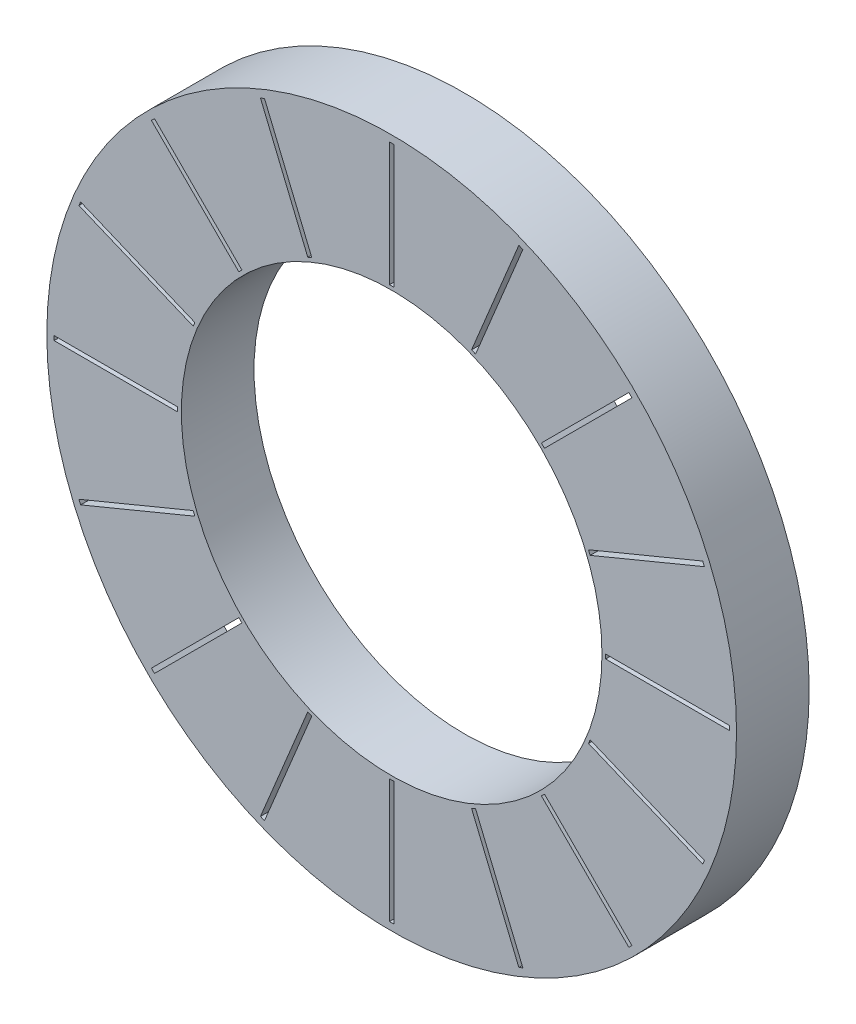
from build123d import *

# Parameters (mm, degrees)
ESQUISSE1_R             = 46.46108
BOSS_EXTRU_1_DEPTH      = 10
ESQUISSE2_R             = 29.44481
ENL_V_MAT_EXTRU_1_DEPTH = 67.462500025
ESQUISSE4_W             = 0.6
ESQUISSE4_H             = 40
ESQUISSE4_W_2           = 40
ESQUISSE4_H_2           = 0.6
ENL_V_MAT_EXTRU_2_DEPTH = 10
ESQUISSE5_R             = 29.44481
BOSS_EXTRU_2_DEPTH      = 10
ESQUISSE6_R             = 28.94481
ENL_V_MAT_EXTRU_3_DEPTH = 67.461145864
ESQUISSE7_R             = 47.46108
ESQUISSE7_R_2           = 46.46108
BOSS_EXTRU_3_DEPTH      = 10


with BuildPart() as part:
    # Esquisse1 → Boss.-Extru.1 (new body)
    with BuildSketch(Plane.XY):
        Circle(ESQUISSE1_R)
    extrude(amount=BOSS_EXTRU_1_DEPTH)

    # Esquisse2 → Enlèv. mat.-Extru.1 (cut, through all)
    with BuildSketch(Plane.XY.offset(10)):
        Circle(ESQUISSE2_R)
    extrude(amount=-ENL_V_MAT_EXTRU_1_DEPTH, mode=Mode.SUBTRACT)

    # Esquisse4 → Enlèv. mat.-Extru.2 (cut)
    with BuildSketch(Plane.XY.offset(10)):
        Polygon((23.238169802, 55.317966921), (7.930832507, 18.362785621), (7.376504788, 18.59239568), (22.683842082, 55.54757698), align=None)
        with Locations((0, 40)):
            Rectangle(ESQUISSE4_W, ESQUISSE4_H)
        Polygon((42.638538906, 42.214274837), (14.354267658, 13.930003589), (13.930003589, 14.354267658), (42.214274837, 42.638538906), align=None)
        Polygon((55.54757698, 22.683842082), (18.59239568, 7.376504788), (18.362785621, 7.930832507), (55.317966921, 23.238169802), align=None)
        with Locations((40, 0)):
            Rectangle(ESQUISSE4_W_2, ESQUISSE4_H_2)
        Polygon((55.317966921, -23.238169802), (18.362785621, -7.930832507), (18.59239568, -7.376504788), (55.54757698, -22.683842082), align=None)
        Polygon((42.214274837, -42.638538906), (13.930003589, -14.354267658), (14.354267658, -13.930003589), (42.638538906, -42.214274837), align=None)
        Polygon((22.683842082, -55.54757698), (7.376504788, -18.59239568), (7.930832507, -18.362785621), (23.238169802, -55.317966921), align=None)
        with Locations((0, -40)):
            Rectangle(ESQUISSE4_W, ESQUISSE4_H)
        Polygon((-23.238169802, -55.317966921), (-7.930832507, -18.362785621), (-7.376504788, -18.59239568), (-22.683842082, -55.54757698), align=None)
        Polygon((-42.638538906, -42.214274837), (-14.354267658, -13.930003589), (-13.930003589, -14.354267658), (-42.214274837, -42.638538906), align=None)
        Polygon((-55.54757698, -22.683842082), (-18.59239568, -7.376504788), (-18.362785621, -7.930832507), (-55.317966921, -23.238169802), align=None)
        with Locations((-40, 0)):
            Rectangle(ESQUISSE4_W_2, ESQUISSE4_H_2)
        Polygon((-55.317966921, 23.238169802), (-18.362785621, 7.930832507), (-18.59239568, 7.376504788), (-55.54757698, 22.683842082), align=None)
        Polygon((-42.214274837, 42.638538906), (-13.930003589, 14.354267658), (-14.354267658, 13.930003589), (-42.638538906, 42.214274837), align=None)
        Polygon((-22.683842082, 55.54757698), (-7.376504788, 18.59239568), (-7.930832507, 18.362785621), (-23.238169802, 55.317966921), align=None)
    extrude(amount=-ENL_V_MAT_EXTRU_2_DEPTH, mode=Mode.SUBTRACT)


with BuildPart() as enl_v_mat_extru_2_piece_1:
    # of the separate pieces the step leaves, piece 1, a body of its own (enl_v_mat_extru_2_pieces)
    add(part.part.solids().sort_by_distance((-32.640127818, -33.064391886, 0))[0])



with BuildPart() as enl_v_mat_extru_2_piece_2:
    # of the separate pieces the step leaves, piece 2, a body of its own (enl_v_mat_extru_2_pieces)
    add(part.part.solids().sort_by_distance((-18.056678773, 42.808741005, 0))[0])


with BuildPart() as enl_v_mat_extru_2_piece_3:
    # of the separate pieces the step leaves, piece 3, a body of its own (enl_v_mat_extru_2_pieces)
    add(part.part.solids().sort_by_distance((-42.808741005, -18.056678773, 0))[0])


with BuildPart() as enl_v_mat_extru_2_piece_4:
    # of the separate pieces the step leaves, piece 4, a body of its own (enl_v_mat_extru_2_pieces)
    add(part.part.solids().sort_by_distance((-33.064391886, 32.640127818, 0))[0])


with BuildPart() as enl_v_mat_extru_2_piece_5:
    # of the separate pieces the step leaves, piece 5, a body of its own (enl_v_mat_extru_2_pieces)
    add(part.part.solids().sort_by_distance((17.502351053, 43.038351065, 0))[0])


with BuildPart() as enl_v_mat_extru_2_piece_6:
    # of the separate pieces the step leaves, piece 6, a body of its own (enl_v_mat_extru_2_pieces)
    add(part.part.solids().sort_by_distance((0.3, -46.460111437, 0))[0])


with BuildPart() as enl_v_mat_extru_2_piece_7:
    # of the separate pieces the step leaves, piece 7, a body of its own (enl_v_mat_extru_2_pieces)
    add(part.part.solids().sort_by_distance((-0.3, 46.460111437, 0))[0])


with BuildPart() as enl_v_mat_extru_2_piece_8:
    # of the separate pieces the step leaves, piece 8, a body of its own (enl_v_mat_extru_2_pieces)
    add(part.part.solids().sort_by_distance((46.460111437, 0.3, 0))[0])


with BuildPart() as enl_v_mat_extru_2_piece_9:
    # of the separate pieces the step leaves, piece 9, a body of its own (enl_v_mat_extru_2_pieces)
    add(part.part.solids().sort_by_distance((43.038351065, -17.502351053, 0))[0])


with BuildPart() as enl_v_mat_extru_2_piece_10:
    # of the separate pieces the step leaves, piece 10, a body of its own (enl_v_mat_extru_2_pieces)
    add(part.part.solids().sort_by_distance((-17.502351053, -43.038351065, 0))[0])


with BuildPart() as enl_v_mat_extru_2_piece_11:
    # of the separate pieces the step leaves, piece 11, a body of its own (enl_v_mat_extru_2_pieces)
    add(part.part.solids().sort_by_distance((32.640127818, 33.064391886, 0))[0])


with BuildPart() as enl_v_mat_extru_2_piece_12:
    # of the separate pieces the step leaves, piece 12, a body of its own (enl_v_mat_extru_2_pieces)
    add(part.part.solids().sort_by_distance((42.808741005, 18.056678773, 0))[0])


with BuildPart() as enl_v_mat_extru_2_piece_13:
    # of the separate pieces the step leaves, piece 13, a body of its own (enl_v_mat_extru_2_pieces)
    add(part.part.solids().sort_by_distance((18.056678773, -42.808741005, 0))[0])


with BuildPart() as enl_v_mat_extru_2_piece_14:
    # of the separate pieces the step leaves, piece 14, a body of its own (enl_v_mat_extru_2_pieces)
    add(part.part.solids().sort_by_distance((33.064391886, -32.640127818, 0))[0])


with BuildPart() as enl_v_mat_extru_2_piece_15:
    # of the separate pieces the step leaves, piece 15, a body of its own (enl_v_mat_extru_2_pieces)
    add(part.part.solids().sort_by_distance((-46.460111437, -0.3, 0))[0])


with BuildPart() as enl_v_mat_extru_2_piece_16:
    # of the separate pieces the step leaves, piece 16, a body of its own (enl_v_mat_extru_2_pieces)
    add(part.part.solids().sort_by_distance((-43.038351065, 17.502351053, 0))[0])


with BuildPart() as enl_v_mat_extru_2_piece_1_1:
    add(enl_v_mat_extru_2_piece_1.part)

    add(enl_v_mat_extru_2_piece_2.part)  # Boss.-Extru.2 merges Enlèv. mat.-Extru.2 piece 2

    add(enl_v_mat_extru_2_piece_3.part)  # Boss.-Extru.2 merges Enlèv. mat.-Extru.2 piece 3

    add(enl_v_mat_extru_2_piece_4.part)  # Boss.-Extru.2 merges Enlèv. mat.-Extru.2 piece 4

    add(enl_v_mat_extru_2_piece_5.part)  # Boss.-Extru.2 merges Enlèv. mat.-Extru.2 piece 5

    add(enl_v_mat_extru_2_piece_6.part)  # Boss.-Extru.2 merges Enlèv. mat.-Extru.2 piece 6

    add(enl_v_mat_extru_2_piece_7.part)  # Boss.-Extru.2 merges Enlèv. mat.-Extru.2 piece 7

    add(enl_v_mat_extru_2_piece_8.part)  # Boss.-Extru.2 merges Enlèv. mat.-Extru.2 piece 8

    add(enl_v_mat_extru_2_piece_9.part)  # Boss.-Extru.2 merges Enlèv. mat.-Extru.2 piece 9

    add(enl_v_mat_extru_2_piece_10.part)  # Boss.-Extru.2 merges Enlèv. mat.-Extru.2 piece 10

    add(enl_v_mat_extru_2_piece_11.part)  # Boss.-Extru.2 merges Enlèv. mat.-Extru.2 piece 11

    add(enl_v_mat_extru_2_piece_12.part)  # Boss.-Extru.2 merges Enlèv. mat.-Extru.2 piece 12

    add(enl_v_mat_extru_2_piece_13.part)  # Boss.-Extru.2 merges Enlèv. mat.-Extru.2 piece 13

    add(enl_v_mat_extru_2_piece_14.part)  # Boss.-Extru.2 merges Enlèv. mat.-Extru.2 piece 14

    add(enl_v_mat_extru_2_piece_15.part)  # Boss.-Extru.2 merges Enlèv. mat.-Extru.2 piece 15

    add(enl_v_mat_extru_2_piece_16.part)  # Boss.-Extru.2 merges Enlèv. mat.-Extru.2 piece 16
    # Esquisse5 → Boss.-Extru.2 (add)
    with BuildSketch(Plane.XY):
        Circle(ESQUISSE5_R)
    extrude(amount=BOSS_EXTRU_2_DEPTH)

    # Esquisse6 → Enlèv. mat.-Extru.3 (cut, through all)
    with BuildSketch(Plane.XY.offset(10)):
        Circle(ESQUISSE6_R)
    extrude(amount=-ENL_V_MAT_EXTRU_3_DEPTH, mode=Mode.SUBTRACT)

    # Esquisse7 → Boss.-Extru.3 (add)
    with BuildSketch(Plane.XY):
        Circle(ESQUISSE7_R)
        Circle(ESQUISSE7_R_2, mode=Mode.SUBTRACT)
    extrude(amount=BOSS_EXTRU_3_DEPTH)


solid = enl_v_mat_extru_2_piece_1_1.part
